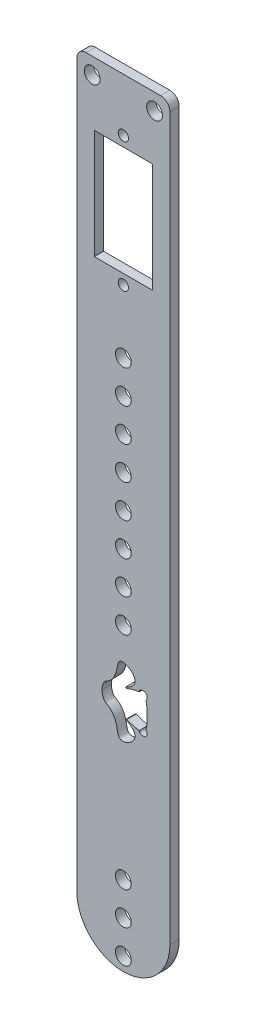
from build123d import *

# Parameters (mm, degrees)
SKETCH_3_R      = 1.700000006
SKETCH_3_R_2    = 1.100000006
SKETCH_3_W      = 12.5
SKETCH_3_H      = 23.5
EXTRUDE_2_DEPTH = 2


with BuildPart() as part:
    # 草图3 → 凸台-拉伸2 (new body)
    with BuildSketch(Plane.XY):
        with BuildLine():
            Line((16.840804288, 56.117583031), (0.840804288, 56.117583031))
            ThreePointArc((0.840804288, 56.117583031), (-0.573409274, 55.531796593), (-1.159195712, 54.117583031))
            Line((-1.159195712, 54.117583031), (-1.159195712, -100.882416969))
            ThreePointArc((-1.159195712, -100.882416969), (8.840804288, -110.882416969), (18.840804288, -100.882416969))
            Line((18.840804288, -100.882416969), (18.840804288, 54.117583031))
            ThreePointArc((18.840804288, 54.117583031), (18.255017851, 55.531796593), (16.840804288, 56.117583031))
        make_face()
        with Locations((8.840804288, -107.982416969)):
            Circle(SKETCH_3_R, mode=Mode.SUBTRACT)
        with BuildLine():
            ThreePointArc((10.540804288, -93.782416969), (7.63872276, -94.984498497), (8.840804288, -92.082416969))
            ThreePointArc((8.840804288, -92.082416969), (10.042885816, -92.580335441), (10.540804288, -93.782416969))
        make_face(mode=Mode.SUBTRACT)
        with BuildLine():
            ThreePointArc((10.540804294, -46.401557681), (10.04288582, -47.603639213), (8.840804288, -48.101557686))
            ThreePointArc((8.840804288, -48.101557686), (7.638722756, -45.199476149), (10.540804294, -46.401557681))
        make_face(mode=Mode.SUBTRACT)
        with Locations((8.840804288, -39.301557681)):
            Circle(SKETCH_3_R, mode=Mode.SUBTRACT)
        with Locations((8.840804288, -32.201557681)):
            Circle(SKETCH_3_R, mode=Mode.SUBTRACT)
        with Locations((8.840804288, -100.882416969)):
            Circle(SKETCH_3_R, mode=Mode.SUBTRACT)
        with BuildLine():
            add(Edge.make_bspline(
                [(8.840804288, -68.07230608), (10.518584029, -67.9276906), (13.271622127, -65.4378125), (9.324741551, -63.725127446)],
                knots=[0.615915535, 0.615915535, 0.615915535, 0.615915535, 1, 1, 1, 1], degree=3))
            add(Edge.make_bspline(
                [(5.004317127, -62.675716717), (6.671990842, -63.522758583), (7.358746233, -65.159768504), (7.765991833, -67.969605562), (8.568188953, -68.095804038), (8.840804288, -68.07230608)],
                knots=[0.002348501, 0.002348501, 0.002348501, 0.002348501, 0.410926836, 0.553507274, 0.615915535, 0.615915535, 0.615915535, 0.615915535], degree=3))
            add(Edge.make_bspline(
                [(4.975444833, -62.661146677), (4.985052333, -62.666591164), (4.994678321, -62.671455775), (5.004317127, -62.675716717)],
                knots=[0.565822578, 0.565822578, 0.565822578, 0.565822578, 0.579602808, 0.579602808, 0.579602808, 0.579602808], degree=3))
            add(Edge.make_bspline(
                [(4.278018154, -60.704640985), (4.226627162, -61.157219039), (4.526861731, -62.258746315), (4.916709377, -62.627861804), (4.975444833, -62.661146677)],
                knots=[0, 0, 0, 0, 0.481577142, 0.565822578, 0.565822578, 0.565822578, 0.565822578], degree=3))
            add(Edge.make_bspline(
                [(4.278018154, -60.704640985), (4.226627162, -60.252062931), (4.526861731, -59.150535655), (4.916709377, -58.781420166), (4.975444833, -58.748135293)],
                knots=[0, 0, 0, 0, 0.481577142, 0.565822578, 0.565822578, 0.565822578, 0.565822578], degree=3))
            add(Edge.make_bspline(
                [(4.975444833, -58.748135293), (4.985052333, -58.742690806), (4.994678321, -58.737826195), (5.004317127, -58.733565253)],
                knots=[0.565822578, 0.565822578, 0.565822578, 0.565822578, 0.579602808, 0.579602808, 0.579602808, 0.579602808], degree=3))
            add(Edge.make_bspline(
                [(5.004317127, -58.733565253), (6.671990842, -57.886523387), (7.358746233, -56.249513466), (7.765991833, -53.439676408), (8.568188953, -53.313477932), (8.840804288, -53.33697589)],
                knots=[0.002348501, 0.002348501, 0.002348501, 0.002348501, 0.410926836, 0.553507274, 0.615915535, 0.615915535, 0.615915535, 0.615915535], degree=3))
            add(Edge.make_bspline(
                [(8.840804288, -53.33697589), (10.518584029, -53.481591371), (13.271622127, -55.97146947), (9.324741551, -57.684154524)],
                knots=[0.615915535, 0.615915535, 0.615915535, 0.615915535, 1, 1, 1, 1], degree=3))
            add(Edge.make_bspline(
                [(9.324741551, -57.684154524), (9.448361201, -57.741607127), (9.579397012, -57.825403241)],
                knots=[0.879374293, 0.879374293, 0.879374293, 1, 1, 1], degree=2))
            add(Edge.make_bspline(
                [(9.579397012, -57.825403241), (10.442809677, -57.472287252), (11.335132803, -57.233463092), (12.256366661, -57.108930725)],
                knots=[0, 0, 0, 0, 0.985819408, 0.985819408, 0.985819408, 0.985819408], degree=3))
            add(Edge.make_bspline(
                [(12.256366661, -57.108930725), (12.250375457, -57.017628974), (12.324042897, -56.451578095), (14.134987008, -56.284356721), (14.027647091, -57.656331575), (13.69790824, -57.940504606)],
                knots=[0.192175897, 0.192175897, 0.192175897, 0.192175897, 0.262471761, 0.642903714, 1, 1, 1, 1], degree=3))
            add(Edge.make_bspline(
                [(13.69790824, -57.940504606), (14.014754559, -59.307854638), (13.928049408, -60.704640985)],
                knots=[0, 0, 0, 1, 1, 1], degree=2))
            add(Edge.make_bspline(
                [(13.69790824, -63.468777364), (14.014754559, -62.101427332), (13.928049408, -60.704640985)],
                knots=[0, 0, 0, 1, 1, 1], degree=2))
            add(Edge.make_bspline(
                [(12.256366661, -64.300351246), (12.250375457, -64.391652996), (12.324042897, -64.957703875), (14.134987008, -65.124925249), (14.027647091, -63.752950395), (13.69790824, -63.468777364)],
                knots=[0.192175897, 0.192175897, 0.192175897, 0.192175897, 0.262471761, 0.642903714, 1, 1, 1, 1], degree=3))
            add(Edge.make_bspline(
                [(9.579397012, -63.583878729), (10.442809677, -63.936994718), (11.335132803, -64.175818878), (12.256366661, -64.300351246)],
                knots=[0, 0, 0, 0, 0.985819408, 0.985819408, 0.985819408, 0.985819408], degree=3))
            add(Edge.make_bspline(
                [(9.324741551, -63.725127446), (9.448361201, -63.667674843), (9.579397012, -63.583878729)],
                knots=[0.879374293, 0.879374293, 0.879374293, 1, 1, 1], degree=2))
        make_face(mode=Mode.SUBTRACT)
        with Locations((8.840804288, -25.101557681)):
            Circle(SKETCH_3_R, mode=Mode.SUBTRACT)
        with Locations((8.840804288, -18.001557681)):
            Circle(SKETCH_3_R, mode=Mode.SUBTRACT)
        with Locations((8.840804288, -10.901557681)):
            Circle(SKETCH_3_R, mode=Mode.SUBTRACT)
        with Locations((8.840804288, -3.801557681)):
            Circle(SKETCH_3_R, mode=Mode.SUBTRACT)
        with Locations((8.840804288, 3.298442319)):
            Circle(SKETCH_3_R, mode=Mode.SUBTRACT)
        with Locations((2.140804288, 52.617583031)):
            Circle(SKETCH_3_R, mode=Mode.SUBTRACT)
        with Locations((8.840804288, 16.888295099)):
            Circle(SKETCH_3_R_2, mode=Mode.SUBTRACT)
        with Locations((8.840804288, 30.788295099)):
            Rectangle(SKETCH_3_W, SKETCH_3_H, mode=Mode.SUBTRACT)
        with Locations((8.840804288, 44.688295099)):
            Circle(SKETCH_3_R_2, mode=Mode.SUBTRACT)
        with Locations((15.540804288, 52.617583031)):
            Circle(SKETCH_3_R, mode=Mode.SUBTRACT)
    extrude(amount=EXTRUDE_2_DEPTH)


solid = part.part
